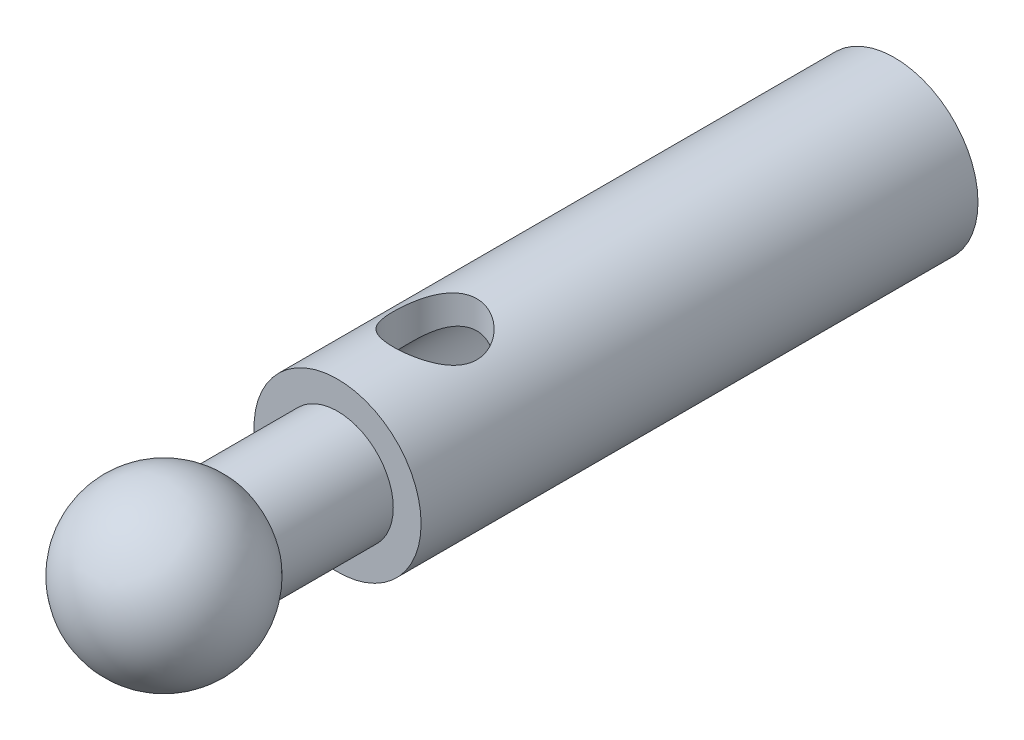
from build123d import *

# Parameters (mm, degrees)
TAGLIO_ESTRUSIONE1_DEPTH      = 9.653279386
TAGLIO_ESTRUSIONE1_DEPTH_BACK = 9.653279386
SCHIZZO2_R                    = 0.75


with BuildPart() as part:
    # Schizzo1 → Rivoluzione1 (revolve)
    with BuildSketch(Plane(origin=(0, 0, 0), x_dir=(0, 0, -1), z_dir=(1, 0, 0)), mode=Mode.PRIVATE) as rivoluzione1_sk:
        with BuildLine():
            Line((8.389233822, 1.5), (-1.610766178, 1.5))
            Line((-1.610766178, 1.5), (-1.610766178, 1))
            Line((-1.610766178, 1), (-3.610766178, 1))
            ThreePointArc((-3.610766178, 1), (-5.264033301, 1.401258538), (-6.228800167, 0))
            Line((-6.228800167, 0), (-0.610766178, 0))
            Line((-0.610766178, 0), (-0.610766178, 1))
            Line((-0.610766178, 1), (8.389233822, 1))
            Line((8.389233822, 1), (8.389233822, 1.5))
        make_face()
    revolve(rivoluzione1_sk.sketch.rotate(Axis((0, 0, 6.228800167), (0, 0, -1)), 90), axis=Axis((0, 0, 6.228800167), (0, 0, -1)))

    # Schizzo2 → Taglio-Estrusione1 (cut, two sides: drawn at the far end of the back side and taken through both)
    with BuildSketch(Plane(origin=(0, 0, 0), x_dir=(1, 0, 0), z_dir=(0, 1, 0)).offset(-TAGLIO_ESTRUSIONE1_DEPTH_BACK)):
        with Locations(Location((0, 0.139233822, 0), (0, 0, 270))):
            Circle(SCHIZZO2_R)
    extrude(amount=TAGLIO_ESTRUSIONE1_DEPTH + TAGLIO_ESTRUSIONE1_DEPTH_BACK, mode=Mode.SUBTRACT)


solid = part.part
